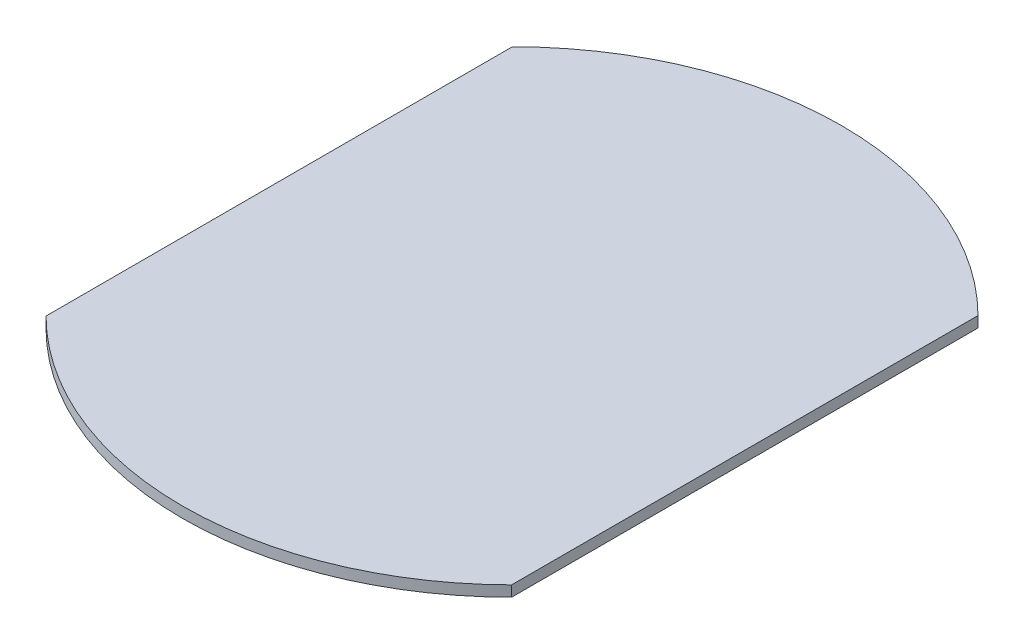
from build123d import *

# Parameters (mm, degrees)
EXTRUDE_1_DEPTH = 0.75


with BuildPart() as part:
    # Эскиз1 → Бобышка-Вытянуть1 (new, symmetric)
    with BuildSketch(Plane(origin=(0, 0, 0), x_dir=(1, 0, 0), z_dir=(0, 1, 0))):
        with BuildLine():
            Line((32.5, -32.553801621), (32.5, 32.553801621))
            ThreePointArc((32.5, 32.553801621), (0, 46), (-32.5, 32.553801621))
            Line((-32.5, 32.553801621), (-32.5, -32.553801621))
            ThreePointArc((-32.5, -32.553801621), (0, -46), (32.5, -32.553801621))
        make_face()
    extrude(amount=EXTRUDE_1_DEPTH, both=True)


solid = part.part
